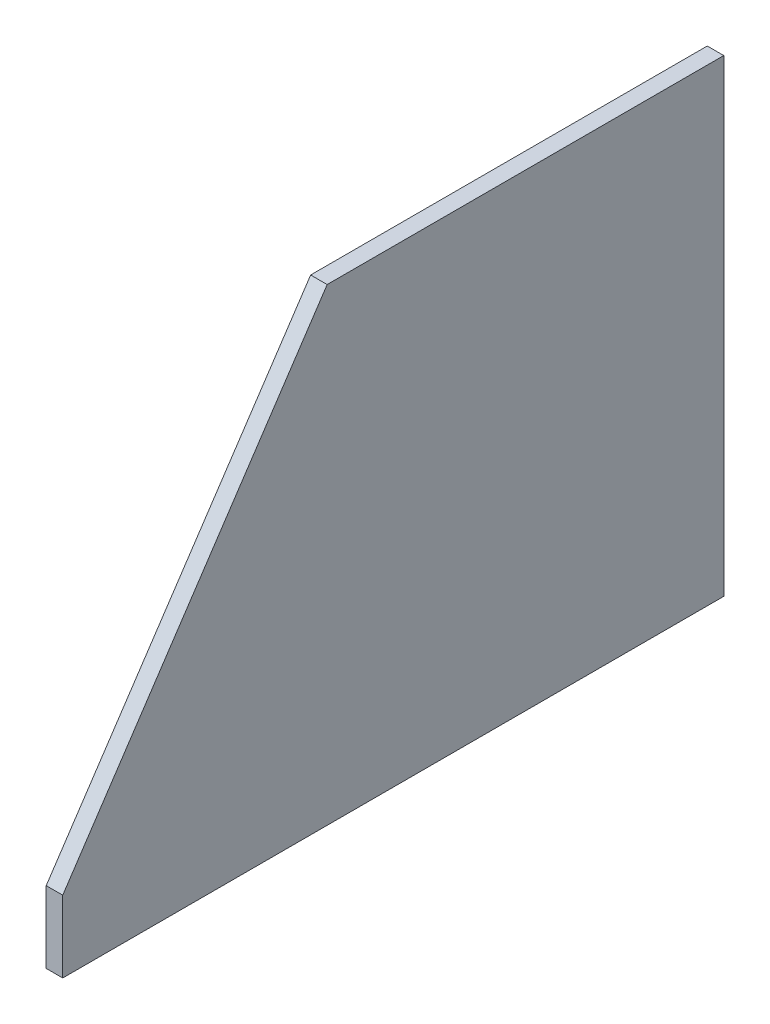
from build123d import *

# Parameters (mm, degrees)
BOSS_EXTRU_1_DEPTH = 6.35


with BuildPart() as part:
    # Esquisse2 → Boss.-Extru.1 (new body)
    with BuildSketch(Plane(origin=(0, 0, 0), x_dir=(0, 0, -1), z_dir=(1, 0, 0))):
        Polygon((0, -27.559), (0, 152.4), (-152.4, 152.4), (-254, 0), (-254, -27.559), align=None)
    extrude(amount=BOSS_EXTRU_1_DEPTH)


solid = part.part
